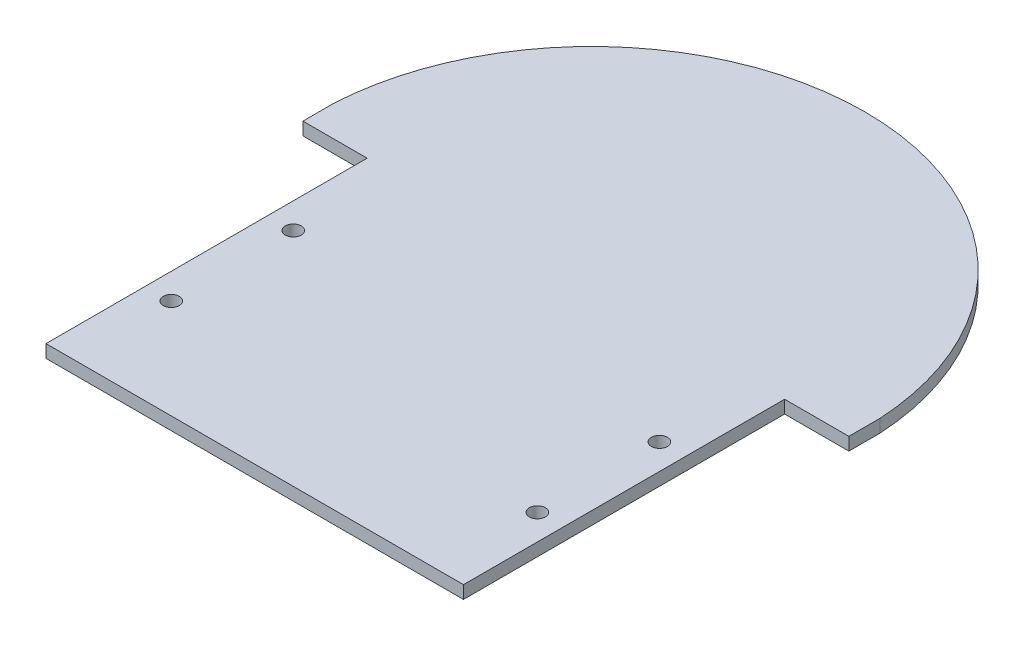
from build123d import *

# Parameters (mm, degrees)
BOSS_EXTRUDE1_DEPTH = 2
SKETCH2_R           = 1.25
CUT_EXTRUDE1_DEPTH  = 2


with BuildPart() as part:
    # Sketch1 → Boss-Extrude1 (new body)
    with BuildSketch(Plane(origin=(0, 0, 0), x_dir=(1, 0, 0), z_dir=(0, 1, 0))):
        with BuildLine():
            Line((-32.5, 2.5), (-32.5, -47.5))
            Line((-32.5, -47.5), (32.5, -47.5))
            Line((32.5, -47.5), (32.5, 2.5))
            Line((32.5, 2.5), (42.5, 2.5))
            Line((42.5, 2.5), (42.5, 7.361111111))
            ThreePointArc((42.5, 7.361111111), (29.229182401, 35.879101507), (1.65e-07, 47.5))
            ThreePointArc((1.65e-07, 47.5), (-29.229182281, 35.87910162), (-42.5, 7.361111111))
            Line((-42.5, 7.361111111), (-42.5, 2.5))
            Line((-42.5, 2.5), (-32.5, 2.5))
        make_face()
    extrude(amount=BOSS_EXTRUDE1_DEPTH)

    # Sketch2 → Cut-Extrude1 (cut)
    with BuildSketch(Plane(origin=(0, 0, 0), x_dir=(1, 0, 0), z_dir=(0, 1, 0))):
        with Locations(Location((-28.5, -13, 0), (0, 0, 270))):
            Circle(SKETCH2_R)
        with Locations(Location((-28.5, -32, 0), (0, 0, 90))):
            Circle(SKETCH2_R)
        with Locations(Location((28.5, -32, 0), (0, 0, 270))):
            Circle(SKETCH2_R)
        with Locations(Location((28.5, -13, 0), (0, 0, 90))):
            Circle(SKETCH2_R)
    extrude(amount=CUT_EXTRUDE1_DEPTH, mode=Mode.SUBTRACT)


solid = part.part
